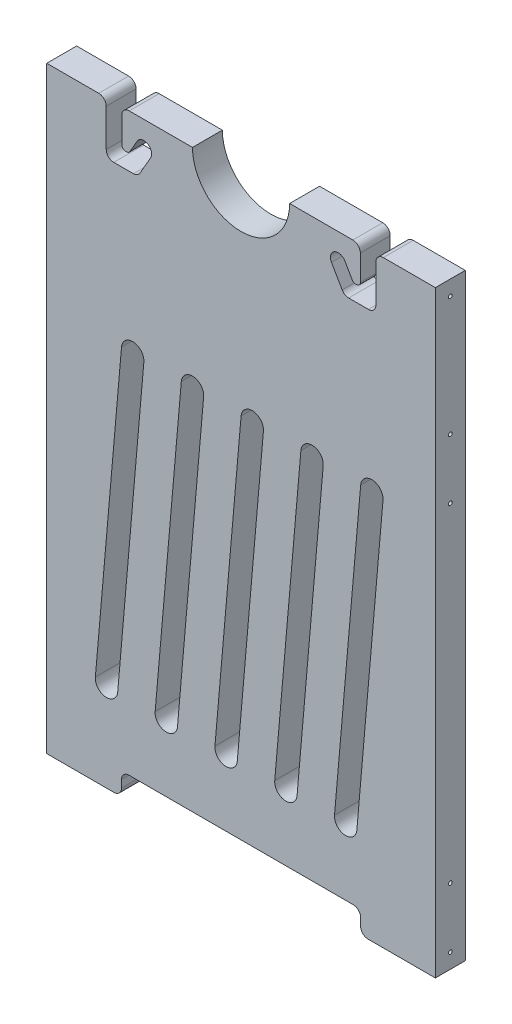
from build123d import *

# Parameters (mm, degrees)
SKETCH1_W                          = 165.1
SKETCH1_H                          = 12.7
BOSS_EXTRUDE1_DEPTH                = 127
SKETCH2_R                          = 20.6375
CUT_EXTRUDE1_DEPTH                 = 153.002606886
CUT_EXTRUDE3_DEPTH                 = 153.002606886
FILLET1_R                          = 3.175
FILLET2_R                          = 1.5875
SKETCH5_W                          = 101.6
SKETCH5_H                          = 9.525
CUT_EXTRUDE4_DEPTH                 = 153.002606886
FILLET3_R                          = 3.175
F_1_16_0_0625_DIAMETER_HOLE1_D     = 1.5875
F_1_16_0_0625_DIAMETER_HOLE1_DEPTH = 15.875
F_1_16_0_0625_DIAMETER_HOLE1_TIP   = 0.476933116
F_1_16_0_0625_DIAMETER_HOLE2_D     = 1.5875
F_1_16_0_0625_DIAMETER_HOLE2_DEPTH = 15.875
F_1_16_0_0625_DIAMETER_HOLE2_TIP   = 0.476933116
CUT_EXTRUDE5_DEPTH                 = 153.002606886


with BuildPart() as part:
    # Sketch1 → Boss-Extrude1 (new, symmetric)
    with BuildSketch(Plane(origin=(0, 0, 0), x_dir=(1, 0, 0), z_dir=(0, 1, 0))):
        Rectangle(SKETCH1_W, SKETCH1_H)
    extrude(amount=BOSS_EXTRUDE1_DEPTH, both=True)

    # Sketch2 → Cut-Extrude1 (cut, through all)
    with BuildSketch(Plane.XY.offset(6.35)):
        with Locations((0, 127)):
            Circle(SKETCH2_R)
    extrude(amount=-CUT_EXTRUDE1_DEPTH, mode=Mode.SUBTRACT)

    # Sketch4 → Cut-Extrude3 (cut, through all)
    with BuildSketch(Plane.XY.offset(6.35)):
        with BuildLine():
            Line((57.277, 127), (57.277, 104.775))
            Line((57.277, 104.775), (43.877983689, 104.775))
            Line((43.877983689, 104.775), (38.415383769, 114.236500603))
            ThreePointArc((38.415383769, 114.236500603), (39.624000301, 118.747116057), (44.134615883, 117.5385))
            Line((44.134615883, 117.5385), (47.690804866, 111.379))
            Line((47.690804866, 111.379), (50.673, 111.379))
            Line((50.673, 111.379), (50.673, 127))
            Line((50.673, 127), (57.277, 127))
        make_face()
        with BuildLine():
            Line((-50.673, 127), (-57.277, 127))
            Line((-57.277, 127), (-57.277, 104.775))
            Line((-57.277, 104.775), (-43.877983689, 104.775))
            Line((-43.877983689, 104.775), (-38.415383769, 114.236500603))
            ThreePointArc((-38.415383769, 114.236500603), (-39.624000301, 118.747116057), (-44.134615883, 117.5385))
            Line((-44.134615883, 117.5385), (-47.690804866, 111.379))
            Line((-47.690804866, 111.379), (-50.673, 111.379))
            Line((-50.673, 111.379), (-50.673, 127))
        make_face()
    extrude(amount=-CUT_EXTRUDE3_DEPTH, mode=Mode.SUBTRACT)

    # Fillet1
    fillet1_edges = [part.edges().sort_by_distance(p)[0] for p in [
        (50.673, 127, 0),
        (57.277, 127, 0),
        (57.277, 104.775, 0),
        (43.877983689, 104.775, 0),
        (-43.877983689, 104.775, 0),
        (-57.277, 104.775, 0),
        (-57.277, 127, 0),
        (-50.673, 127, 0),
    ]]
    fillet(fillet1_edges, radius=FILLET1_R)

    # Fillet2
    fillet2_edges = [part.edges().sort_by_distance(p)[0] for p in [
        (47.690804866, 111.379, 0),
        (50.673, 111.379, 0),
        (-50.673, 111.379, 0),
        (-47.690804866, 111.379, 0),
    ]]
    fillet(fillet2_edges, radius=FILLET2_R)

    # Sketch5 → Cut-Extrude4 (cut, through all)
    with BuildSketch(Plane.XY.offset(6.35)):
        with Locations((0, -122.2375)):
            Rectangle(SKETCH5_W, SKETCH5_H)
    extrude(amount=-CUT_EXTRUDE4_DEPTH, mode=Mode.SUBTRACT)

    # Fillet3
    fillet3_edges = [part.edges().sort_by_distance(p)[0] for p in [
        (-50.8, -127, 0),
        (-50.8, -117.475, 0),
        (50.8, -117.475, 0),
        (50.8, -127, 0),
    ]]
    fillet(fillet3_edges, radius=FILLET3_R)

    # 1/16 (0.0625) Diameter Hole1
    with Locations(Plane(origin=(82.55, 0, 0), x_dir=(0, 0, -1), z_dir=(1, 0, 0))):
        with Locations((0, -120.65), (0, -95.25), (0, 44.45), (0, 69.85), (0, 120.65)):
            Hole(F_1_16_0_0625_DIAMETER_HOLE1_D / 2, depth=F_1_16_0_0625_DIAMETER_HOLE1_DEPTH)
            with Locations((0, 0, -(F_1_16_0_0625_DIAMETER_HOLE1_DEPTH + F_1_16_0_0625_DIAMETER_HOLE1_TIP / 2))):  # 118° drill point
                Cone(0, F_1_16_0_0625_DIAMETER_HOLE1_D / 2, F_1_16_0_0625_DIAMETER_HOLE1_TIP, mode=Mode.SUBTRACT)

    # 1/16 (0.0625) Diameter Hole2
    with Locations(Plane.ZY.offset(82.55)):
        with Locations((0, -120.65), (0, -95.25), (0, 44.45), (0, 69.85), (0, 120.65)):
            Hole(F_1_16_0_0625_DIAMETER_HOLE2_D / 2, depth=F_1_16_0_0625_DIAMETER_HOLE2_DEPTH)
            with Locations((0, 0, -(F_1_16_0_0625_DIAMETER_HOLE2_DEPTH + F_1_16_0_0625_DIAMETER_HOLE2_TIP / 2))):  # 118° drill point
                Cone(0, F_1_16_0_0625_DIAMETER_HOLE2_D / 2, F_1_16_0_0625_DIAMETER_HOLE2_TIP, mode=Mode.SUBTRACT)

    # Sketch10 → Cut-Extrude5 (cut, through all)
    with BuildSketch(Plane.XY.offset(6.35)):
        with BuildLine():
            Line((-61.89437725, -88.484920775), (-50.783316982, 38.515079225))
            ThreePointArc((-50.783316982, 38.515079225), (-45.623860507, 42.84437725), (-41.294562483, 37.684920775))
            Line((-41.294562483, 37.684920775), (-52.40562275, -89.315079225))
            ThreePointArc((-52.40562275, -89.315079225), (-57.565079225, -93.64437725), (-61.89437725, -88.484920775))
        make_face()
        with BuildLine():
            Line((-27.00562275, -89.315079225), (-15.894562483, 37.684920775))
            ThreePointArc((-15.894562483, 37.684920775), (-20.223860507, 42.84437725), (-25.383316982, 38.515079225))
            Line((-25.383316982, 38.515079225), (-36.49437725, -88.484920775))
            ThreePointArc((-36.49437725, -88.484920775), (-32.165079225, -93.64437725), (-27.00562275, -89.315079225))
        make_face()
        with BuildLine():
            Line((-1.60562275, -89.315079225), (9.505437517, 37.684920775))
            ThreePointArc((9.505437517, 37.684920775), (5.176139493, 42.84437725), (0.016683018, 38.515079225))
            Line((0.016683018, 38.515079225), (-11.09437725, -88.484920775))
            ThreePointArc((-11.09437725, -88.484920775), (-6.765079225, -93.64437725), (-1.60562275, -89.315079225))
        make_face()
        with BuildLine():
            Line((23.79437725, -89.315079225), (34.905437517, 37.684920775))
            ThreePointArc((34.905437517, 37.684920775), (30.576139493, 42.84437725), (25.416683018, 38.515079225))
            Line((25.416683018, 38.515079225), (14.30562275, -88.484920775))
            ThreePointArc((14.30562275, -88.484920775), (18.634920775, -93.64437725), (23.79437725, -89.315079225))
        make_face()
        with BuildLine():
            Line((49.19437725, -89.315079225), (60.305437517, 37.684920775))
            ThreePointArc((60.305437517, 37.684920775), (55.976139493, 42.84437725), (50.816683018, 38.515079225))
            Line((50.816683018, 38.515079225), (39.70562275, -88.484920775))
            ThreePointArc((39.70562275, -88.484920775), (44.034920775, -93.64437725), (49.19437725, -89.315079225))
        make_face()
    extrude(amount=-CUT_EXTRUDE5_DEPTH, mode=Mode.SUBTRACT)


solid = part.part
